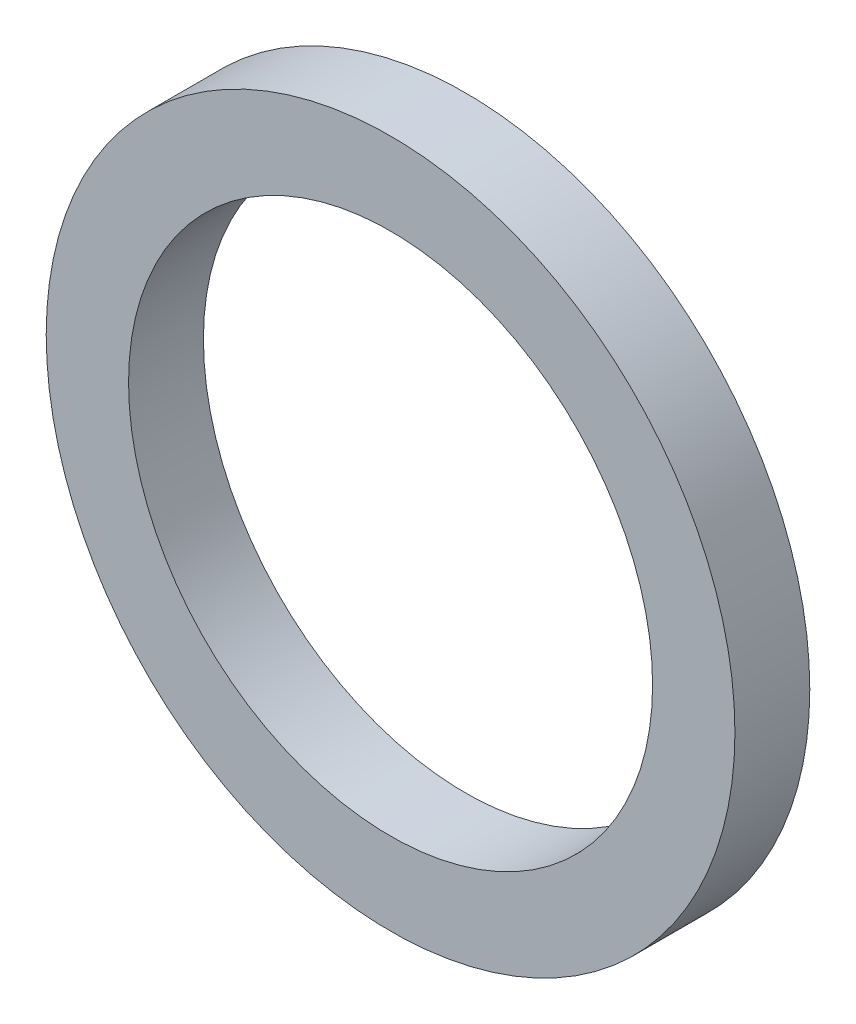
from build123d import *

# Parameters (mm, degrees)
SKETCH_1_R      = 46
SKETCH_1_R_2    = 35
EXTRUDE_1_DEPTH = 10


with BuildPart() as part:
    # 草图1 → 拉伸1 (new body)
    with BuildSketch(Plane.XY):
        Circle(SKETCH_1_R)
        Circle(SKETCH_1_R_2, mode=Mode.SUBTRACT)
    extrude(amount=EXTRUDE_1_DEPTH)


solid = part.part
